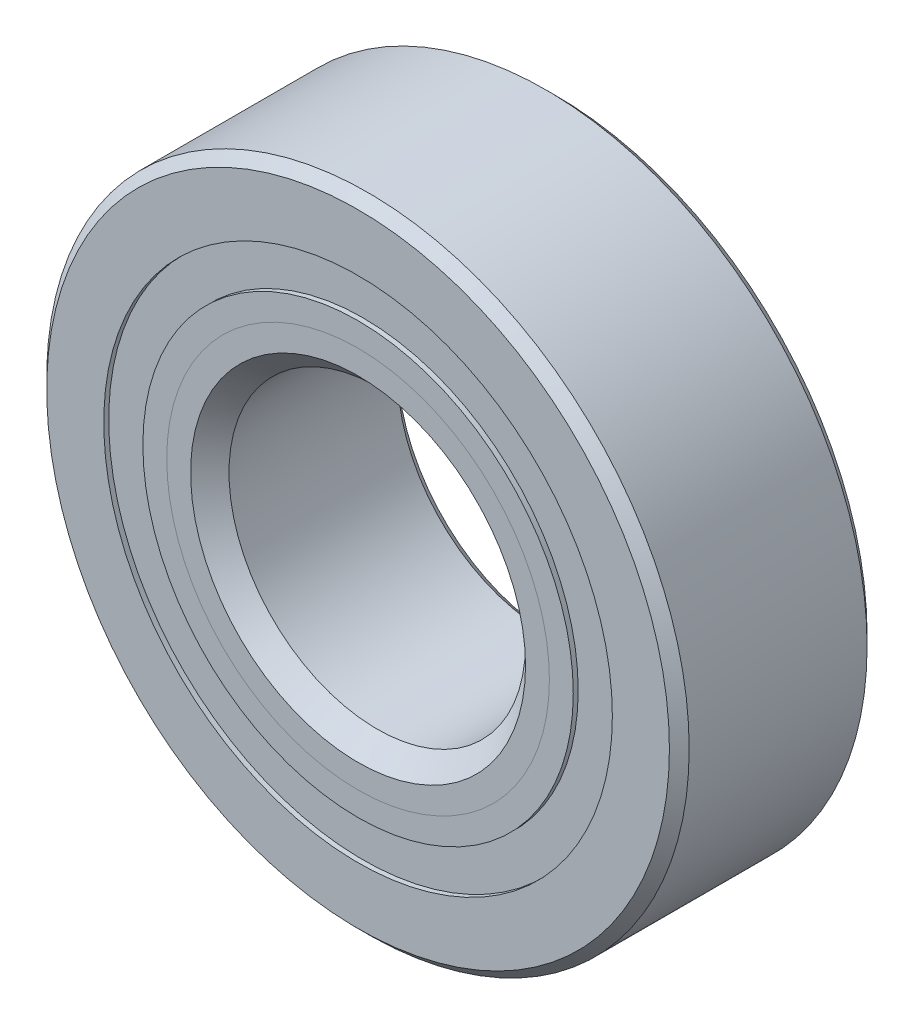
from build123d import *

# Parameters (mm, degrees)
CIRPATTERN1_COUNT = 14
SKETCH5_W         = 2.943392574
SKETCH5_H         = 2.512087912


with BuildPart() as part:
    # Sketch1 → Revolve1 (revolve)
    with BuildSketch(Plane(origin=(0, 0, 0), x_dir=(0, 0, -1), z_dir=(1, 0, 0))):
        with BuildLine():
            Line((5.715, 20.6375), (-5.715, 20.6375))
            Line((-5.715, 20.6375), (-6.35, 20.0025))
            Line((-6.35, 20.0025), (-6.35, 16.337293956))
            Line((-6.35, 16.337293956), (-2.822222222, 16.337293956))
            ThreePointArc((-2.822222222, 16.337293956), (0, 18.170357426), (2.822222222, 16.337293956))
            Line((2.822222222, 16.337293956), (6.35, 16.337293956))
            Line((6.35, 16.337293956), (6.35, 20.0025))
            Line((6.35, 20.0025), (5.715, 20.6375))
        make_face()
    revolve(axis=Axis((0, 0, 6.35), (0, 0, -1)))


with BuildPart() as body_2:
    # Sketch2 → Revolve2 (revolve)
    with BuildSketch(Plane(origin=(0, 0, 0), x_dir=(0, 0, -1), z_dir=(1, 0, 0))):
        with BuildLine():
            Line((-6.35, 13.825206044), (-2.822222222, 13.825206044))
            ThreePointArc((-2.822222222, 13.825206044), (-1.682636321, 12.490628511), (0, 11.992142574))
            Line((0, 11.992142574), (0, 10.758571287))
            Line((0, 10.758571287), (-4.816682621, 10.758571287))
            Line((-4.816682621, 10.758571287), (-6.35, 12.291888665))
            Line((-6.35, 12.291888665), (-6.35, 13.825206044))
        make_face()
    revolve(axis=Axis((0, 0, 6.35), (0, 0, -1)))


with BuildPart() as body_3:
    # Sketch3 → Revolve3 (revolve)
    with BuildSketch(Plane(origin=(0, 0, 0), x_dir=(0, 0, -1), z_dir=(1, 0, 0))):
        with BuildLine():
            Line((-6.35, 12.291888665), (-4.816682621, 10.758571287))
            Line((-4.816682621, 10.758571287), (0, 10.758571287))
            Line((0, 10.758571287), (0, 11.992142574))
            ThreePointArc((0, 11.992142574), (1.682636321, 12.490628511), (2.822222222, 13.825206044))
            Line((2.822222222, 13.825206044), (6.35, 13.825206044))
            Line((6.35, 13.825206044), (6.35, 10.16))
            Line((6.35, 10.16), (5.715, 9.525))
            Line((5.715, 9.525), (-5.116428713, 9.525))
            Line((-5.116428713, 9.525), (-6.35, 10.758571287))
            Line((-6.35, 10.758571287), (-6.35, 12.291888665))
        make_face()
    revolve(axis=Axis((0, 0, 6.35), (0, 0, -1)))


with BuildPart() as body_4:
    # Sketch4 → Revolve4 (revolve)
    with BuildSketch(Plane(origin=(0, 0, 0), x_dir=(0, 0, -1), z_dir=(1, 0, 0))):
        with BuildLine():
            Line((-3.089107426, 15.08125), (3.089107426, 15.08125))
            ThreePointArc((3.089107426, 15.08125), (0, 18.170357426), (-3.089107426, 15.08125))
        make_face()
    revolve(axis=Axis((0, 15.08125, 3.089107426), (0, 0, -1)))


with BuildPart() as cirpattern1_1:
    # CirPattern1: pattern copy
    add(body_4.part.rotate(Axis((0, 0, -6.35), (0, 0, 1)), 1 * 360 / CIRPATTERN1_COUNT))


with BuildPart() as cirpattern1_2:
    # CirPattern1: pattern copy
    add(body_4.part.rotate(Axis((0, 0, -6.35), (0, 0, 1)), 2 * 360 / CIRPATTERN1_COUNT))


with BuildPart() as cirpattern1_3:
    # CirPattern1: pattern copy
    add(body_4.part.rotate(Axis((0, 0, -6.35), (0, 0, 1)), 3 * 360 / CIRPATTERN1_COUNT))


with BuildPart() as cirpattern1_4:
    # CirPattern1: pattern copy
    add(body_4.part.rotate(Axis((0, 0, -6.35), (0, 0, 1)), 4 * 360 / CIRPATTERN1_COUNT))


with BuildPart() as cirpattern1_5:
    # CirPattern1: pattern copy
    add(body_4.part.rotate(Axis((0, 0, -6.35), (0, 0, 1)), 5 * 360 / CIRPATTERN1_COUNT))


with BuildPart() as cirpattern1_6:
    # CirPattern1: pattern copy
    add(body_4.part.rotate(Axis((0, 0, -6.35), (0, 0, 1)), 6 * 360 / CIRPATTERN1_COUNT))


with BuildPart() as cirpattern1_7:
    # CirPattern1: pattern copy
    add(body_4.part.rotate(Axis((0, 0, -6.35), (0, 0, 1)), 7 * 360 / CIRPATTERN1_COUNT))


with BuildPart() as cirpattern1_8:
    # CirPattern1: pattern copy
    add(body_4.part.rotate(Axis((0, 0, -6.35), (0, 0, 1)), 8 * 360 / CIRPATTERN1_COUNT))


with BuildPart() as cirpattern1_9:
    # CirPattern1: pattern copy
    add(body_4.part.rotate(Axis((0, 0, -6.35), (0, 0, 1)), 9 * 360 / CIRPATTERN1_COUNT))


with BuildPart() as cirpattern1_10:
    # CirPattern1: pattern copy
    add(body_4.part.rotate(Axis((0, 0, -6.35), (0, 0, 1)), 10 * 360 / CIRPATTERN1_COUNT))


with BuildPart() as cirpattern1_11:
    # CirPattern1: pattern copy
    add(body_4.part.rotate(Axis((0, 0, -6.35), (0, 0, 1)), 11 * 360 / CIRPATTERN1_COUNT))


with BuildPart() as cirpattern1_12:
    # CirPattern1: pattern copy
    add(body_4.part.rotate(Axis((0, 0, -6.35), (0, 0, 1)), 12 * 360 / CIRPATTERN1_COUNT))


with BuildPart() as cirpattern1_13:
    # CirPattern1: pattern copy
    add(body_4.part.rotate(Axis((0, 0, -6.35), (0, 0, 1)), 13 * 360 / CIRPATTERN1_COUNT))


with BuildPart() as body_18:
    # Sketch5 → Revolve5 (revolve)
    with BuildSketch(Plane(origin=(0, 0, 0), x_dir=(0, 0, -1), z_dir=(1, 0, 0))):
        with Locations((-4.560803713, 15.08125)):
            Rectangle(SKETCH5_W, SKETCH5_H)
        with Locations((4.560803713, 15.08125)):
            Rectangle(SKETCH5_W, SKETCH5_H)
    revolve(axis=Axis((0, 0, 6.35), (0, 0, -1)))


solid = Compound([part.part, body_2.part, body_3.part, body_4.part, cirpattern1_1.part, cirpattern1_2.part, cirpattern1_3.part, cirpattern1_4.part, cirpattern1_5.part, cirpattern1_6.part, cirpattern1_7.part, cirpattern1_8.part, cirpattern1_9.part, cirpattern1_10.part, cirpattern1_11.part, cirpattern1_12.part, cirpattern1_13.part, body_18.part])
